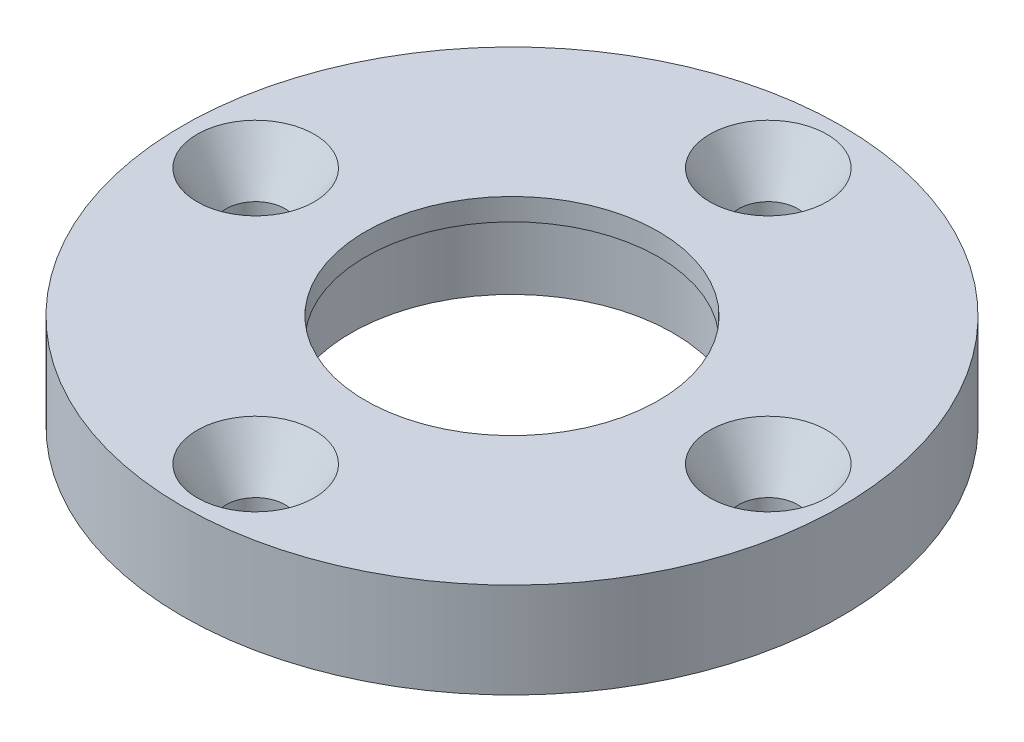
from build123d import *

# Parameters (mm, degrees)
SKETCH_1_R          = 22.5
SKETCH_1_R_2        = 10
EXTRUDE_1_DEPTH     = 6.5
SKETCH_2_R          = 2
CUT_EXTRUDE_1_DEPTH = 33.476914878
SKETCH_3_R          = 11
CUT_EXTRUDE_2_DEPTH = 5
CHAMFER_1_SIZE      = 2
CHAMFER_1_SIZE2     = 3.4


with BuildPart() as part:
    # 草图1 → 凸台-拉伸1 (new body)
    with BuildSketch(Plane(origin=(0, 0, 0), x_dir=(1, 0, 0), z_dir=(0, 1, 0))):
        with Locations(Location((0, 0, 0), (0, 0, 90))):
            Circle(SKETCH_1_R)
        with Locations(Location((0, 0, 0), (0, 0, 90))):
            Circle(SKETCH_1_R_2, mode=Mode.SUBTRACT)
    extrude(amount=EXTRUDE_1_DEPTH)

    # 草图2 → 切除-拉伸1 (cut, through all)
    with BuildSketch(Plane(origin=(0, 6.5, 0), x_dir=(1, 0, 0), z_dir=(0, 1, 0))):
        with Locations(Location((0, 17.5, 0), (0, 0, 270))):
            Circle(SKETCH_2_R)
        with Locations(Location((17.5, 0, 0), (0, 0, 270))):
            Circle(SKETCH_2_R)
        with Locations(Location((0, -17.5, 0), (0, 0, 270))):
            Circle(SKETCH_2_R)
        with Locations(Location((-17.5, 0, 0), (0, 0, 270))):
            Circle(SKETCH_2_R)
    extrude(amount=-CUT_EXTRUDE_1_DEPTH, mode=Mode.SUBTRACT)

    # 草图3 → 切除-拉伸2 (cut)
    with BuildSketch(Plane.XZ):
        with Locations(Location((0, 0, 0), (0, 0, 270))):
            Circle(SKETCH_3_R)
    extrude(amount=-CUT_EXTRUDE_2_DEPTH, mode=Mode.SUBTRACT)

    # 倒角1
    chamfer_1_edges = [part.edges().sort_by_distance(p)[0] for p in [
        (0, 6.5, -19.5),
        (17.5, 6.5, -2),
        (0, 6.5, 15.5),
        (-17.5, 6.5, -2),
    ]]
    chamfer_1_side = [part.faces().sort_by_distance(p)[0] for p in [
        (0, 6.5, 21.863603897),
    ]]
    chamfer(chamfer_1_edges, length=CHAMFER_1_SIZE, length2=CHAMFER_1_SIZE2, reference=chamfer_1_side[0])


solid = part.part
